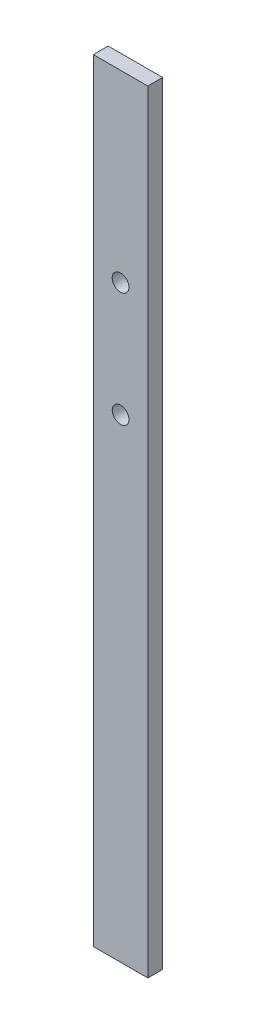
from build123d import *

# Parameters (mm, degrees)
SKETCH1_W                   = 139.7
SKETCH1_H                   = 38.1
BOSS_EXTRUDE1_DEPTH         = 1981.2
F_1_1_6875_DIAMETER_HOLE1_D = 42.8625


with BuildPart() as part:
    # Sketch1 → Boss-Extrude1 (new body)
    with BuildSketch(Plane(origin=(0, 0, 0), x_dir=(1, 0, 0), z_dir=(0, 1, 0))):
        Rectangle(SKETCH1_W, SKETCH1_H)
    extrude(amount=BOSS_EXTRUDE1_DEPTH)

    # 1 (1.6875) Diameter Hole1 (through all)
    with Locations(Plane(origin=(0, 0, -19.05), x_dir=(-1, 0, 0), z_dir=(0, 0, -1))):
        with Locations((0, 1216.025), (0, 1509.7125)):
            Hole(F_1_1_6875_DIAMETER_HOLE1_D / 2)


solid = part.part
